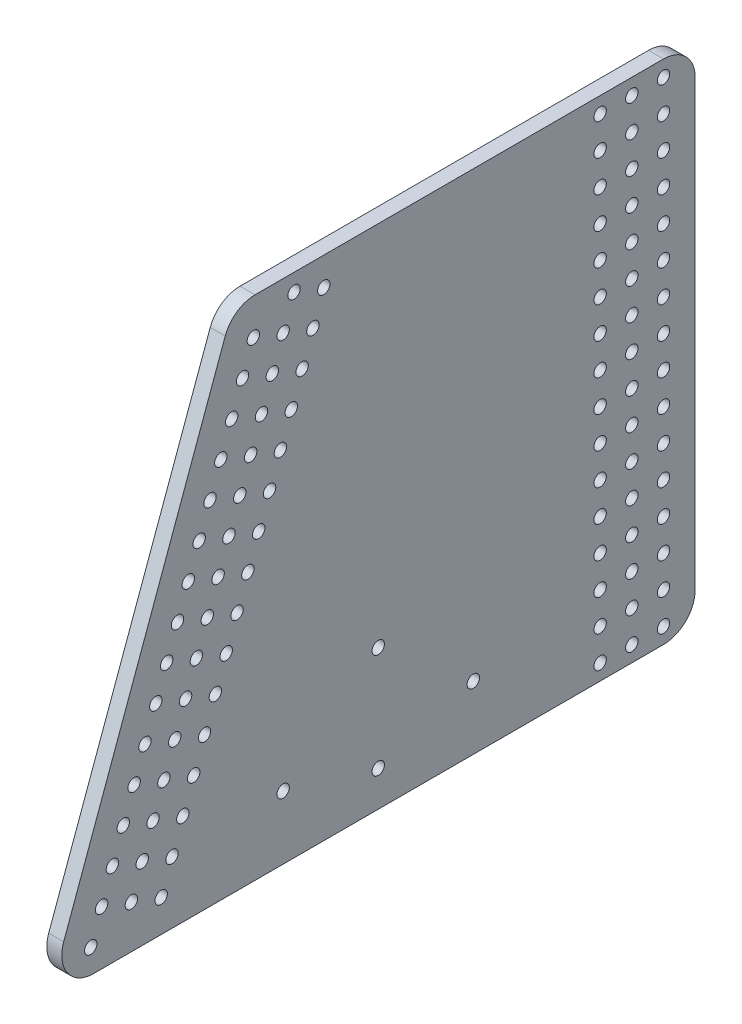
from build123d import *

# Parameters (mm, degrees)
SKETCH1_R           = 2.4892
BOSS_EXTRUDE1_DEPTH = 6
FILLET1_R           = 12.7
SKETCH4_R           = 3.030873179
CUT_EXTRUDE1_DEPTH  = 3.175
SKETCH5_R           = 2.4892
CUT_EXTRUDE2_DEPTH  = 330.429722485


with BuildPart() as part:
    # Sketch1 → Boss-Extrude1 (new body)
    with BuildSketch(Plane(origin=(17.71343226, 0, 0), x_dir=(0, 0, -1), z_dir=(1, 0, 0))):
        Polygon((0, 0), (259.225195644, 0), (259.225195644, 203.2), (73.958751603, 203.2), align=None)
        with Locations((246.525195644, 6.35)):
            Circle(SKETCH1_R, mode=Mode.SUBTRACT)
        with Locations((233.825195644, 6.35)):
            Circle(SKETCH1_R, mode=Mode.SUBTRACT)
        with Locations((221.125195644, 6.35)):
            Circle(SKETCH1_R, mode=Mode.SUBTRACT)
        with Locations((221.125195644, 19.05)):
            Circle(SKETCH1_R, mode=Mode.SUBTRACT)
        with Locations((246.525195644, 19.05)):
            Circle(SKETCH1_R, mode=Mode.SUBTRACT)
        with Locations((233.825195644, 19.05)):
            Circle(SKETCH1_R, mode=Mode.SUBTRACT)
        with Locations((221.125195644, 31.75)):
            Circle(SKETCH1_R, mode=Mode.SUBTRACT)
        with Locations((98.476182982, 196.296457334)):
            Circle(SKETCH1_R, mode=Mode.SUBTRACT)
        with Locations((110.410279266, 191.952801514)):
            Circle(SKETCH1_R, mode=Mode.SUBTRACT)
        with Locations((246.525195644, 31.75)):
            Circle(SKETCH1_R, mode=Mode.SUBTRACT)
        with Locations((233.825195644, 31.75)):
            Circle(SKETCH1_R, mode=Mode.SUBTRACT)
        with Locations((221.125195644, 44.45)):
            Circle(SKETCH1_R, mode=Mode.SUBTRACT)
        with Locations((246.525195644, 44.45)):
            Circle(SKETCH1_R, mode=Mode.SUBTRACT)
        with Locations((233.825195644, 44.45)):
            Circle(SKETCH1_R, mode=Mode.SUBTRACT)
        with Locations((221.125195644, 57.15)):
            Circle(SKETCH1_R, mode=Mode.SUBTRACT)
        with Locations((246.525195644, 57.15)):
            Circle(SKETCH1_R, mode=Mode.SUBTRACT)
        with Locations((233.825195644, 57.15)):
            Circle(SKETCH1_R, mode=Mode.SUBTRACT)
        with Locations((221.125195644, 69.85)):
            Circle(SKETCH1_R, mode=Mode.SUBTRACT)
        with Locations((246.525195644, 69.85)):
            Circle(SKETCH1_R, mode=Mode.SUBTRACT)
        with Locations((233.825195644, 69.85)):
            Circle(SKETCH1_R, mode=Mode.SUBTRACT)
        with Locations((221.125195644, 82.55)):
            Circle(SKETCH1_R, mode=Mode.SUBTRACT)
        with Locations((246.525195644, 82.55)):
            Circle(SKETCH1_R, mode=Mode.SUBTRACT)
        with Locations((233.825195644, 82.55)):
            Circle(SKETCH1_R, mode=Mode.SUBTRACT)
        with Locations((221.125195644, 95.25)):
            Circle(SKETCH1_R, mode=Mode.SUBTRACT)
        with Locations((246.525195644, 95.25)):
            Circle(SKETCH1_R, mode=Mode.SUBTRACT)
        with Locations((233.825195644, 95.25)):
            Circle(SKETCH1_R, mode=Mode.SUBTRACT)
        with Locations((221.125195644, 107.95)):
            Circle(SKETCH1_R, mode=Mode.SUBTRACT)
        with Locations((246.525195644, 107.95)):
            Circle(SKETCH1_R, mode=Mode.SUBTRACT)
        with Locations((233.825195644, 107.95)):
            Circle(SKETCH1_R, mode=Mode.SUBTRACT)
        with Locations((221.125195644, 120.65)):
            Circle(SKETCH1_R, mode=Mode.SUBTRACT)
        with Locations((246.525195644, 120.65)):
            Circle(SKETCH1_R, mode=Mode.SUBTRACT)
        with Locations((233.825195644, 120.65)):
            Circle(SKETCH1_R, mode=Mode.SUBTRACT)
        with Locations((221.125195644, 133.35)):
            Circle(SKETCH1_R, mode=Mode.SUBTRACT)
        with Locations((246.525195644, 133.35)):
            Circle(SKETCH1_R, mode=Mode.SUBTRACT)
        with Locations((233.825195644, 133.35)):
            Circle(SKETCH1_R, mode=Mode.SUBTRACT)
        with Locations((221.125195644, 146.05)):
            Circle(SKETCH1_R, mode=Mode.SUBTRACT)
        with Locations((246.525195644, 146.05)):
            Circle(SKETCH1_R, mode=Mode.SUBTRACT)
        with Locations((233.825195644, 146.05)):
            Circle(SKETCH1_R, mode=Mode.SUBTRACT)
        with Locations((221.125195644, 158.75)):
            Circle(SKETCH1_R, mode=Mode.SUBTRACT)
        with Locations((246.525195644, 158.75)):
            Circle(SKETCH1_R, mode=Mode.SUBTRACT)
        with Locations((233.825195644, 158.75)):
            Circle(SKETCH1_R, mode=Mode.SUBTRACT)
        with Locations((221.125195644, 171.45)):
            Circle(SKETCH1_R, mode=Mode.SUBTRACT)
        with Locations((246.525195644, 171.45)):
            Circle(SKETCH1_R, mode=Mode.SUBTRACT)
        with Locations((233.825195644, 171.45)):
            Circle(SKETCH1_R, mode=Mode.SUBTRACT)
        with Locations((221.125195644, 184.15)):
            Circle(SKETCH1_R, mode=Mode.SUBTRACT)
        with Locations((246.525195644, 184.15)):
            Circle(SKETCH1_R, mode=Mode.SUBTRACT)
        with Locations((233.825195644, 184.15)):
            Circle(SKETCH1_R, mode=Mode.SUBTRACT)
        with Locations((221.125195644, 196.85)):
            Circle(SKETCH1_R, mode=Mode.SUBTRACT)
        with Locations((246.525195644, 196.85)):
            Circle(SKETCH1_R, mode=Mode.SUBTRACT)
        with Locations((233.825195644, 196.85)):
            Circle(SKETCH1_R, mode=Mode.SUBTRACT)
        with Locations((82.198430878, 188.70601687)):
            Circle(SKETCH1_R, mode=Mode.SUBTRACT)
        with Locations((77.854775058, 176.771920587)):
            Circle(SKETCH1_R, mode=Mode.SUBTRACT)
        with Locations((94.132527162, 184.36236105)):
            Circle(SKETCH1_R, mode=Mode.SUBTRACT)
        with Locations((106.066623446, 180.01870523)):
            Circle(SKETCH1_R, mode=Mode.SUBTRACT)
        with Locations((73.511119238, 164.837824303)):
            Circle(SKETCH1_R, mode=Mode.SUBTRACT)
        with Locations((89.788871342, 172.428264766)):
            Circle(SKETCH1_R, mode=Mode.SUBTRACT)
        with Locations((101.722967626, 168.084608946)):
            Circle(SKETCH1_R, mode=Mode.SUBTRACT)
        with Locations((69.167463418, 152.903728019)):
            Circle(SKETCH1_R, mode=Mode.SUBTRACT)
        with Locations((85.445215522, 160.494168482)):
            Circle(SKETCH1_R, mode=Mode.SUBTRACT)
        with Locations((97.379311806, 156.150512662)):
            Circle(SKETCH1_R, mode=Mode.SUBTRACT)
        with Locations((64.823807597, 140.969631735)):
            Circle(SKETCH1_R, mode=Mode.SUBTRACT)
        with Locations((81.101559702, 148.560072198)):
            Circle(SKETCH1_R, mode=Mode.SUBTRACT)
        with Locations((93.035655986, 144.216416378)):
            Circle(SKETCH1_R, mode=Mode.SUBTRACT)
        with Locations((60.480151777, 129.035535451)):
            Circle(SKETCH1_R, mode=Mode.SUBTRACT)
        with Locations((76.757903881, 136.625975914)):
            Circle(SKETCH1_R, mode=Mode.SUBTRACT)
        with Locations((88.692000165, 132.282320094)):
            Circle(SKETCH1_R, mode=Mode.SUBTRACT)
        with Locations((56.136495957, 117.101439167)):
            Circle(SKETCH1_R, mode=Mode.SUBTRACT)
        with Locations((72.414248061, 124.69187963)):
            Circle(SKETCH1_R, mode=Mode.SUBTRACT)
        with Locations((84.348344345, 120.34822381)):
            Circle(SKETCH1_R, mode=Mode.SUBTRACT)
        with Locations((51.792840137, 105.167342883)):
            Circle(SKETCH1_R, mode=Mode.SUBTRACT)
        with Locations((68.070592241, 112.757783346)):
            Circle(SKETCH1_R, mode=Mode.SUBTRACT)
        with Locations((80.004688525, 108.414127526)):
            Circle(SKETCH1_R, mode=Mode.SUBTRACT)
        with Locations((47.449184316, 93.233246599)):
            Circle(SKETCH1_R, mode=Mode.SUBTRACT)
        with Locations((63.726936421, 100.823687062)):
            Circle(SKETCH1_R, mode=Mode.SUBTRACT)
        with Locations((75.661032705, 96.480031242)):
            Circle(SKETCH1_R, mode=Mode.SUBTRACT)
        with Locations((43.105528496, 81.299150315)):
            Circle(SKETCH1_R, mode=Mode.SUBTRACT)
        with Locations((59.3832806, 88.889590778)):
            Circle(SKETCH1_R, mode=Mode.SUBTRACT)
        with Locations((71.317376884, 84.545934958)):
            Circle(SKETCH1_R, mode=Mode.SUBTRACT)
        with Locations((38.761872676, 69.365054031)):
            Circle(SKETCH1_R, mode=Mode.SUBTRACT)
        with Locations((55.03962478, 76.955494494)):
            Circle(SKETCH1_R, mode=Mode.SUBTRACT)
        with Locations((66.973721064, 72.611838674)):
            Circle(SKETCH1_R, mode=Mode.SUBTRACT)
        with Locations((34.418216856, 57.430957747)):
            Circle(SKETCH1_R, mode=Mode.SUBTRACT)
        with Locations((50.69596896, 65.02139821)):
            Circle(SKETCH1_R, mode=Mode.SUBTRACT)
        with Locations((62.630065244, 60.67774239)):
            Circle(SKETCH1_R, mode=Mode.SUBTRACT)
        with Locations((30.074561035, 45.496861463)):
            Circle(SKETCH1_R, mode=Mode.SUBTRACT)
        with Locations((46.35231314, 53.087301926)):
            Circle(SKETCH1_R, mode=Mode.SUBTRACT)
        with Locations((58.286409424, 48.743646106)):
            Circle(SKETCH1_R, mode=Mode.SUBTRACT)
        with Locations((25.730905215, 33.562765179)):
            Circle(SKETCH1_R, mode=Mode.SUBTRACT)
        with Locations((42.008657319, 41.153205642)):
            Circle(SKETCH1_R, mode=Mode.SUBTRACT)
        with Locations((53.942753603, 36.809549822)):
            Circle(SKETCH1_R, mode=Mode.SUBTRACT)
        with Locations((21.387249395, 21.628668895)):
            Circle(SKETCH1_R, mode=Mode.SUBTRACT)
        with Locations((37.665001499, 29.219109359)):
            Circle(SKETCH1_R, mode=Mode.SUBTRACT)
        with Locations((49.599097783, 24.875453538)):
            Circle(SKETCH1_R, mode=Mode.SUBTRACT)
        with Locations((17.043593575, 9.694572611)):
            Circle(SKETCH1_R, mode=Mode.SUBTRACT)
        with Locations((33.321345679, 17.285013075)):
            Circle(SKETCH1_R, mode=Mode.SUBTRACT)
        with Locations((45.255441963, 12.941357254)):
            Circle(SKETCH1_R, mode=Mode.SUBTRACT)
    extrude(amount=BOSS_EXTRUDE1_DEPTH)

    # Fillet1
    fillet1_edges = [part.edges().sort_by_distance(p)[0] for p in [
        (20.71343226, 203.2, -259.225195644),
        (20.71343226, 0, -259.225195644),
        (20.71343226, 0, 0),
        (20.71343226, 203.2, -73.958751603),
    ]]
    fillet(fillet1_edges, radius=FILLET1_R)

    # Sketch4 → Cut-Extrude1 (cut)
    with BuildSketch(Plane.ZY.offset(-17.71343226)):
        with Locations((-183.025195644, 190.5)):
            Circle(SKETCH4_R)
        with Locations((-170.325195644, 190.5)):
            Circle(SKETCH4_R)
        with Locations((-157.625195644, 190.5)):
            Circle(SKETCH4_R)
        with Locations((-144.925195644, 190.5)):
            Circle(SKETCH4_R)
        with Locations((-183.025195644, 76.2)):
            Circle(SKETCH4_R)
        with Locations((-170.325195644, 76.2)):
            Circle(SKETCH4_R)
        with Locations((-157.625195644, 76.2)):
            Circle(SKETCH4_R)
        with Locations((-144.925195644, 76.2)):
            Circle(SKETCH4_R)
        with Locations((-132.225195644, 190.5)):
            Circle(SKETCH4_R)
        with Locations((-132.225195644, 76.2)):
            Circle(SKETCH4_R)
        with Locations((-198.900195644, 158.75)):
            Circle(SKETCH4_R)
        with Locations((-198.900195644, 107.95)):
            Circle(SKETCH4_R)
        with Locations((-116.350195644, 158.75)):
            Circle(SKETCH4_R)
        with Locations((-116.350195644, 107.95)):
            Circle(SKETCH4_R)
    extrude(amount=-CUT_EXTRUDE1_DEPTH, mode=Mode.SUBTRACT)

    # Sketch5 → Cut-Extrude2 (cut, through all)
    with BuildSketch(Plane.ZY.offset(-17.71343226)):
        with Locations((-170.325195644, 25.4)):
            Circle(SKETCH5_R)
        with Locations((-94.125195644, 25.4)):
            Circle(SKETCH5_R)
        with Locations((-132.225195644, 56.134)):
            Circle(SKETCH5_R)
        with Locations((-132.225195644, 14.224)):
            Circle(SKETCH5_R)
    extrude(amount=-CUT_EXTRUDE2_DEPTH, mode=Mode.SUBTRACT)


solid = part.part
